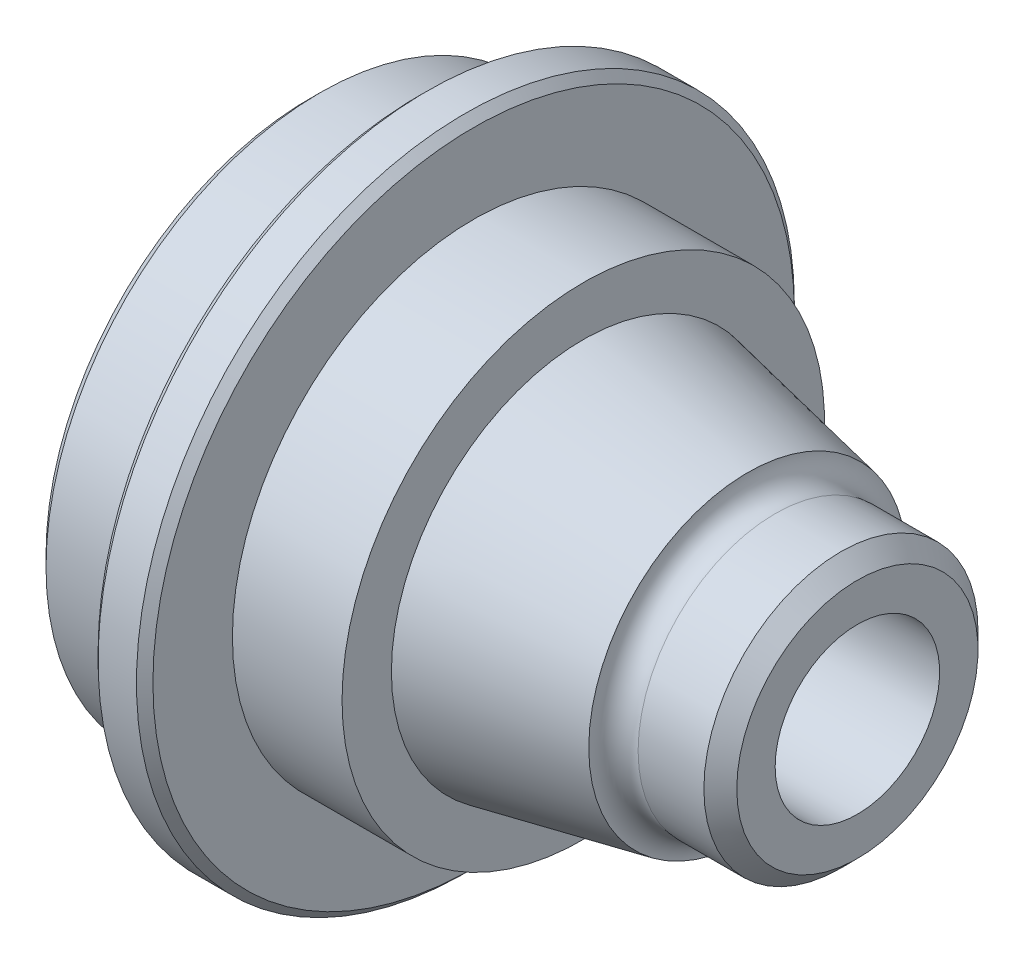
from build123d import *

# Parameters (mm, degrees)
SMUSSO1_SIZE = 2
RACCORDO1_R  = 8
SMUSSO2_SIZE = 1.5
SMUSSO3_SIZE = 3


with BuildPart() as part:
    # Schizzo1 → Rivoluzione1 (revolve)
    with BuildSketch(Plane.XY, mode=Mode.PRIVATE) as rivoluzione1_sk:
        with BuildLine():
            ThreePointArc((-25, 15), (-48.677605909, 30.856025933), (-77, 34))
            Line((-77, 34), (-77, 42))
            Line((-77, 42), (-79, 42))
            Line((-79, 42), (-79, 40))
            Line((-79, 40), (-100, 40))
            Line((-100, 40), (-100, 50))
            Line((-100, 50), (-80, 50))
            Line((-80, 50), (-80, 60))
            Line((-80, 60), (-70, 60))
            Line((-70, 60), (-70, 44))
            Line((-70, 44), (-50, 44))
            Line((-50, 44), (-50, 35))
            Line((-50, 35), (-20, 29))
            ThreePointArc((-20, 29), (-18.500814089, 25.748982388), (-15, 25))
            Line((-15, 25), (0, 25))
            Line((0, 25), (0, 15))
            Line((0, 15), (-25, 15))
        make_face()
    revolve(rivoluzione1_sk.sketch.rotate(Axis((-117.125626325, 0, 0), (1, 0, 0)), 90), axis=Axis((-117.125626325, 0, 0), (1, 0, 0)))

    # Smusso1
    smusso1_edges = [part.edges().sort_by_distance(p)[0] for p in [
        (-100, 0, -40),
        (-100, 0, -50),
    ]]
    chamfer(smusso1_edges, length=SMUSSO1_SIZE)

    # Raccordo1
    raccordo1_edges = [part.edges().sort_by_distance(p)[0] for p in [
        (-25, 0, -15),
    ]]
    fillet(raccordo1_edges, radius=RACCORDO1_R)

    # Smusso2
    smusso2_edges = [part.edges().sort_by_distance(p)[0] for p in [
        (-80, 0, -60),
        (-70, 0, -60),
    ]]
    chamfer(smusso2_edges, length=SMUSSO2_SIZE)

    # Smusso3
    smusso3_edges = [part.edges().sort_by_distance(p)[0] for p in [
        (0, 0, -25),
    ]]
    chamfer(smusso3_edges, length=SMUSSO3_SIZE)


solid = part.part
